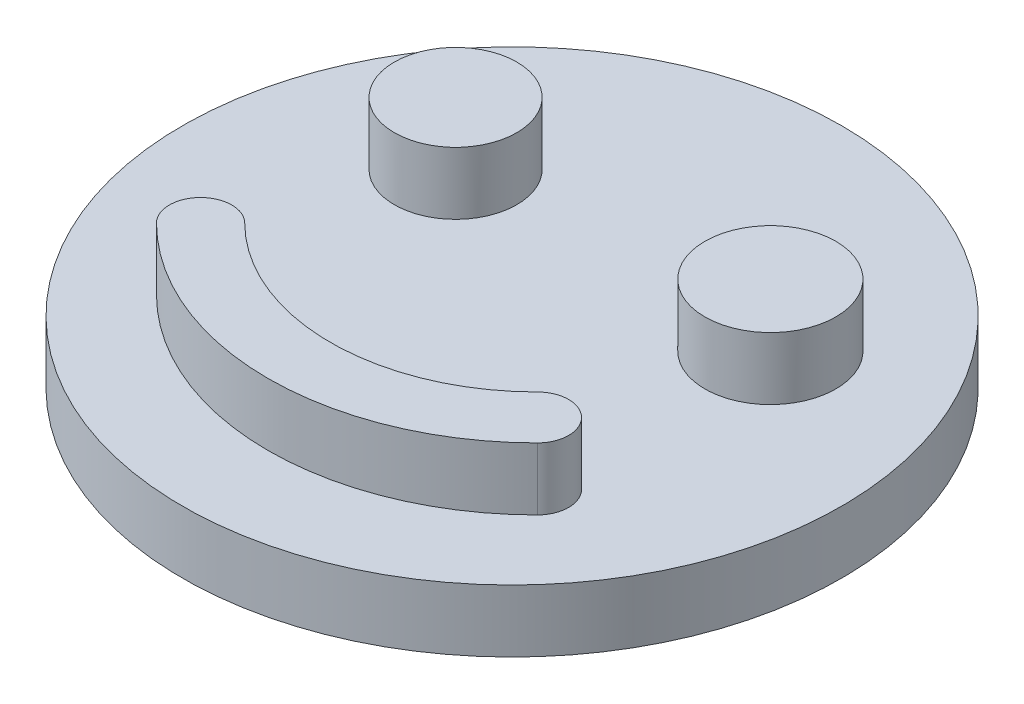
from build123d import *

# Parameters (mm, degrees)
SKETCH1_R             = 9.813093158
BOSS_EXTRUDE1_DEPTH   = 10
SKETCH1_R_2           = 10.498292465
BOSS_EXTRUDE1_2_DEPTH = 10
BOSS_EXTRUDE1_3_DEPTH = 10
SKETCH2_R             = 52.823312211
BOSS_EXTRUDE2_DEPTH   = 10


with BuildPart() as part:
    # Sketch1 → Boss-Extrude1 (new body)
    with BuildSketch(Plane(origin=(0, 0, 0), x_dir=(1, 0, 0), z_dir=(0, 1, 0))):
        with Locations(Location((-31.119938379, 20.059237389, 0), (0, 0, 270))):
            Circle(SKETCH1_R)
    extrude(amount=BOSS_EXTRUDE1_DEPTH)



with BuildPart() as body_2:
    # Sketch1 → Boss-Extrude1 2 (new body)
    with BuildSketch(Plane(origin=(0, 0, 0), x_dir=(1, 0, 0), z_dir=(0, 1, 0))):
        with Locations(Location((19.335746107, 20.059237389, 0), (0, 0, 270))):
            Circle(SKETCH1_R_2)
    extrude(amount=BOSS_EXTRUDE1_2_DEPTH)


with BuildPart() as body_3:
    # Sketch1 → Boss-Extrude1 3 (new body)
    with BuildSketch(Plane(origin=(0, 0, 0), x_dir=(1, 0, 0), z_dir=(0, 1, 0))):
        with BuildLine():
            ThreePointArc((-37.654984417, -21.345137195), (-7.123841316, -33.991550742), (23.407301786, -21.345137195))
            ThreePointArc((23.407301786, -21.345137195), (23.407301786, -14.274069383), (16.336233974, -14.274069383))
            ThreePointArc((16.336233974, -14.274069383), (-7.123841316, -23.991550742), (-30.583916606, -14.274069383))
            ThreePointArc((-30.583916606, -14.274069383), (-37.654984417, -14.274069383), (-37.654984417, -21.345137195))
        make_face()
    extrude(amount=BOSS_EXTRUDE1_3_DEPTH)


with BuildPart() as part_1:
    add(part.part)

    add(body_2.part)  # Boss-Extrude2 merges body 2

    add(body_3.part)  # Boss-Extrude2 merges body 3
    # Sketch2 → Boss-Extrude2 (add)
    with BuildSketch(Plane.XZ):
        with Locations(Location((-6.251130616, -4.246879691, 0), (0, 0, 270))):
            Circle(SKETCH2_R)
    extrude(amount=BOSS_EXTRUDE2_DEPTH)


solid = part_1.part
